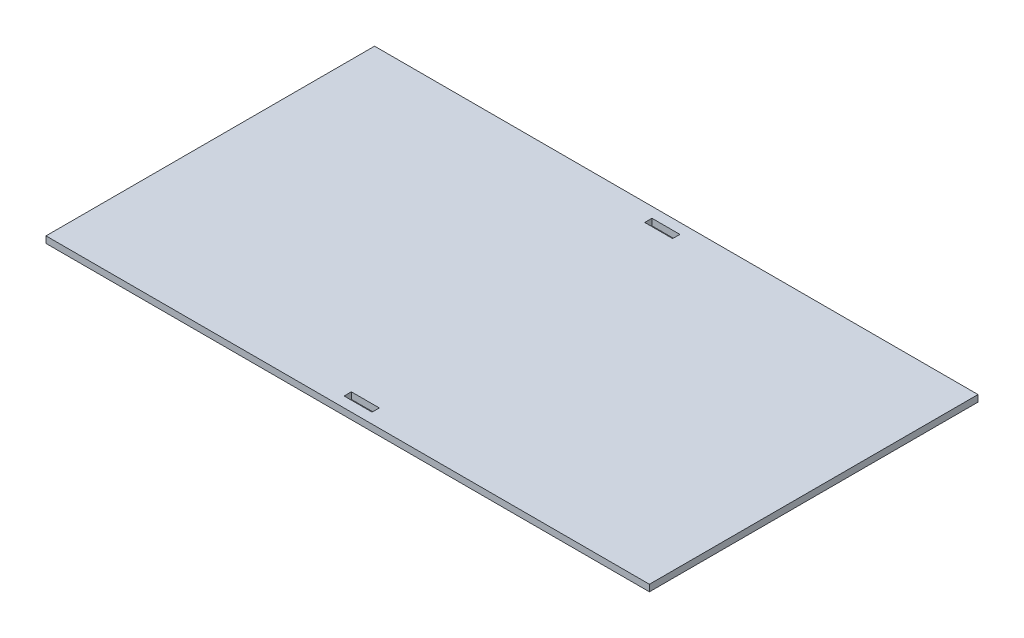
from build123d import *

# Parameters (mm, degrees)
SKETCH1_W           = 274.32
SKETCH1_H           = 149.3774
SKETCH1_W_2         = 12.7
SKETCH1_H_2         = 3.302
BOSS_EXTRUDE1_DEPTH = 2.9972


with BuildPart() as part:
    # Sketch1 → Boss-Extrude1 (new body)
    with BuildSketch(Plane(origin=(0, 0, 0), x_dir=(1, 0, 0), z_dir=(0, 1, 0))):
        Rectangle(SKETCH1_W, SKETCH1_H)
        with Locations((0, 68.326)):
            Rectangle(SKETCH1_W_2, SKETCH1_H_2, mode=Mode.SUBTRACT)
        with Locations((0, -68.326)):
            Rectangle(SKETCH1_W_2, SKETCH1_H_2, mode=Mode.SUBTRACT)
    extrude(amount=BOSS_EXTRUDE1_DEPTH)


solid = part.part
